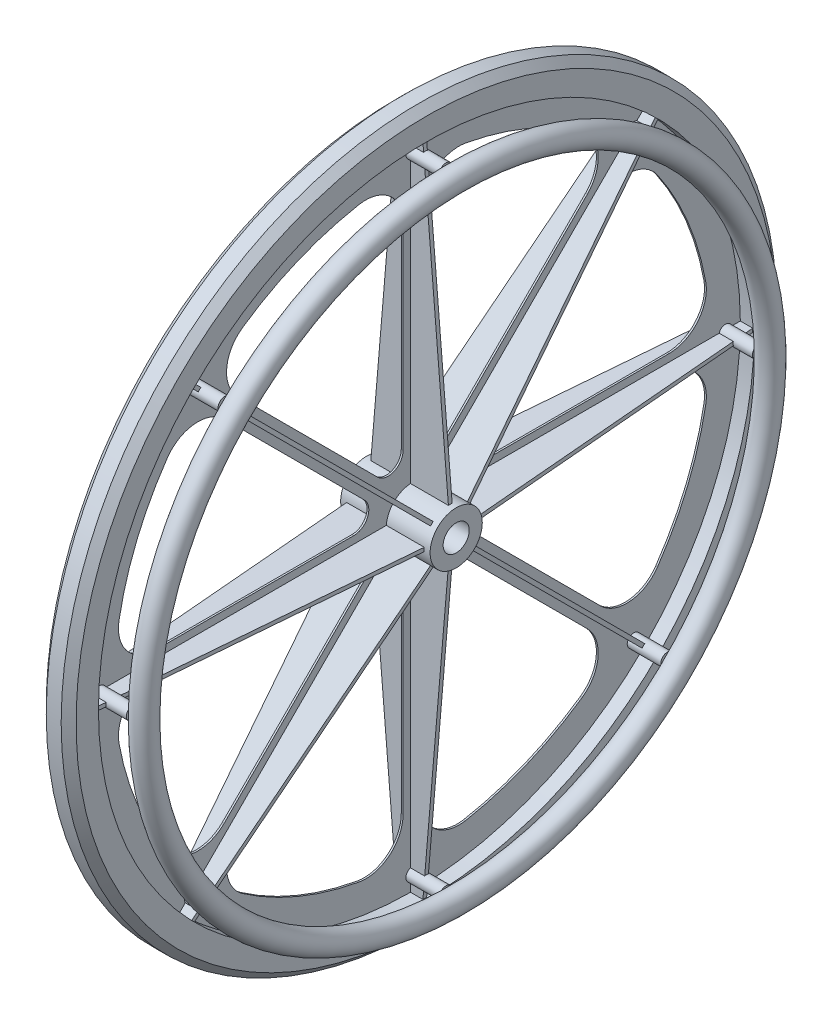
from build123d import *

# Parameters (mm, degrees)
SALIENTE_EXTRUIR1_DEPTH      = 38.1
SALIENTE_EXTRUIR1_DEPTH_BACK = 38.1
CROQUIS1_R                   = 22.225
SALIENTE_EXTRUIR3_DEPTH      = 0.762
SALIENTE_EXTRUIR3_DEPTH_BACK = 0.762
CROQUIS2_R                   = 304.8
SALIENTE_EXTRUIR4_DEPTH      = 12.7
SALIENTE_EXTRUIR4_DEPTH_BACK = 12.7
CROQUIS3_R                   = 304.8
CROQUIS3_R_2                 = 279.4
CORTAR_EXTRUIR2_DEPTH        = 433.800571908
CROQUIS13_R                  = 5.5565
SALIENTE_EXTRUIR5_DEPTH      = 28.575
MATRIZC1_COUNT               = 8
CROQUIS14_R                  = 11.1125
CORTAR_EXTRUIR3_DEPTH        = 438.735673684
CROQUIS15_R                  = 9.525
CHAFL_N1_SIZE                = 6.35


with BuildPart() as part:
    # Croquis1 → Saliente-Extruir1 (new, two sides: drawn at the far end of the back side and taken through both)
    with BuildSketch(Plane(origin=(0, 0, 0), x_dir=(0, 0, -1), z_dir=(1, 0, 0)).offset(-SALIENTE_EXTRUIR1_DEPTH_BACK)):
        Circle(CROQUIS1_R)
    extrude(amount=SALIENTE_EXTRUIR1_DEPTH + SALIENTE_EXTRUIR1_DEPTH_BACK)

    # Croquis2 → Saliente-Extruir3 (add, two sides: drawn at the far end of the back side and taken through both)
    with BuildSketch(Plane(origin=(0, 0, 0), x_dir=(0, 0, -1), z_dir=(1, 0, 0)).offset(-SALIENTE_EXTRUIR3_DEPTH_BACK)):
        Circle(CROQUIS2_R)
    extrude(amount=SALIENTE_EXTRUIR3_DEPTH + SALIENTE_EXTRUIR3_DEPTH_BACK)

    # Croquis3 → Saliente-Extruir4 (add, two sides: drawn at the far end of the back side and taken through both)
    with BuildSketch(Plane(origin=(0, 0, 0), x_dir=(0, 0, -1), z_dir=(1, 0, 0)).offset(-SALIENTE_EXTRUIR4_DEPTH_BACK)):
        Circle(CROQUIS3_R)
        Circle(CROQUIS3_R_2, mode=Mode.SUBTRACT)
    extrude(amount=SALIENTE_EXTRUIR4_DEPTH + SALIENTE_EXTRUIR4_DEPTH_BACK)

    # Croquis4 → Cortar-Extruir2 (cut, through all)
    with BuildSketch(Plane(origin=(0.762, 0, 0), x_dir=(0, 0, -1), z_dir=(1, 0, 0))):
        with BuildLine():
            Line((7.9375, 218.677764859), (7.9375, 49.823332393))
            ThreePointArc((7.9375, 49.823332393), (15.777420409, 38.090062331), (29.617756121, 40.843076272))
            Line((29.617756121, 40.843076272), (149.015870351, 160.241190502))
            ThreePointArc((149.015870351, 160.241190502), (158.187392862, 185.538112411), (144.645977198, 208.790663777))
            ThreePointArc((144.645977198, 208.790663777), (97.201591821, 234.665401258), (45.357142857, 249.917445553))
            ThreePointArc((45.357142857, 249.917445553), (19.339879263, 243.050635645), (7.9375, 218.677764859))
        make_face()
    cortar_extruir2 = extrude(amount=-CORTAR_EXTRUIR2_DEPTH, mode=Mode.SUBTRACT)

    # Croquis9 → Recubrir10 section 0
    with BuildSketch(Plane(origin=(0, 0, 0), x_dir=(1, 0, 0), z_dir=(0, 1, 0))):
        with BuildLine():
            Line((-34.925, 1.5875), (34.925, 1.5875))
            Line((34.925, 1.5875), (34.925, -1.5875))
            Line((34.925, -1.5875), (-34.925, -1.5875))
            Line((-34.925, -1.5875), (-34.925, 1.5875))
        make_face()
    # Croquis10 → Recubrir10 section 1
    with BuildSketch(Plane(origin=(0, 281.94, 0), x_dir=(1, 0, 0), z_dir=(0, 1, 0))):
        with BuildLine():
            Line((-11.1125, 1.5875), (11.1125, 1.5875))
            Line((11.1125, 1.5875), (11.1125, -1.5875))
            Line((11.1125, -1.5875), (-11.1125, -1.5875))
            Line((-11.1125, -1.5875), (-11.1125, 1.5875))
        make_face()
    recubrir10 = loft()

    # Croquis13 → Saliente-Extruir5 (add)
    with BuildSketch(Plane(origin=(0.762, 0, 0), x_dir=(0, 0, -1), z_dir=(1, 0, 0))):
        with Locations((0, 266.7)):
            Circle(CROQUIS13_R)
    saliente_extruir5 = extrude(amount=SALIENTE_EXTRUIR5_DEPTH)

    # MatrizC1: Cortar-Extruir2, Recubrir10, Saliente-Extruir5 ×8 about axis
    matrizc1_axis = Axis((12.7, 0, 0), (1, 0, 0))
    add([cortar_extruir2.rotate(matrizc1_axis, i * 360 / MATRIZC1_COUNT) for i in range(1, MATRIZC1_COUNT)], mode=Mode.SUBTRACT)
    add([recubrir10.rotate(matrizc1_axis, i * 360 / MATRIZC1_COUNT) for i in range(1, MATRIZC1_COUNT)])
    add([saliente_extruir5.rotate(matrizc1_axis, i * 360 / MATRIZC1_COUNT) for i in range(1, MATRIZC1_COUNT)])

    # Croquis14 → Cortar-Extruir3 (cut, through all)
    with BuildSketch(Plane.ZY.offset(38.1)):
        Circle(CROQUIS14_R)
    extrude(amount=-CORTAR_EXTRUIR3_DEPTH, mode=Mode.SUBTRACT)

    # Chaflán1
    chafl_n1_edges = [part.edges().sort_by_distance(p)[0] for p in [
        (-12.7, 0, 304.8),
        (12.7, 0, 304.8),
    ]]
    chamfer(chafl_n1_edges, length=CHAFL_N1_SIZE)


with BuildPart() as body_2:
    # Croquis15 → Revolución1 (revolve)
    with BuildSketch(Plane.XY):
        with Locations((38.862, 266.7)):
            Circle(CROQUIS15_R)
    revolve(axis=Axis((-42.42435, 0, 0), (1, 0, 0)))


solid = Compound([part.part, body_2.part])
